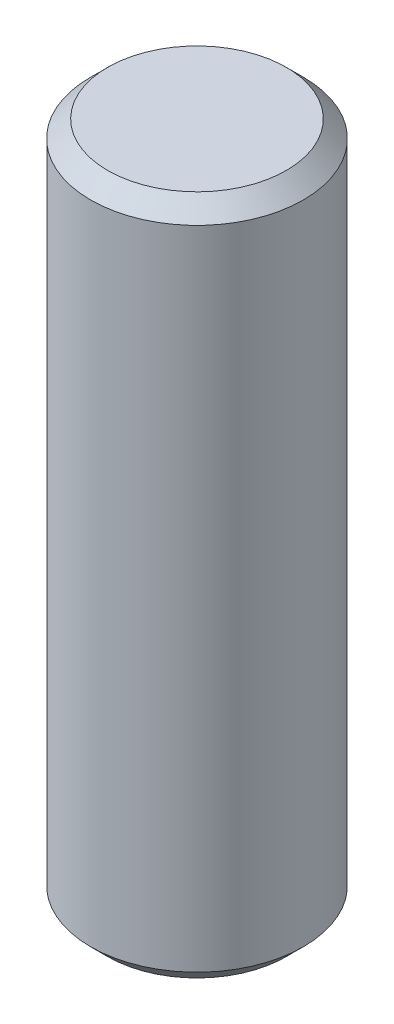
from build123d import *

# Parameters (mm, degrees)
BOSS_EXTRUDE1_DEPTH      = 5.08
BOSS_EXTRUDE1_DEPTH_BACK = 5.08
SKETCH1_R                = 1.5875
CHAMFER1_SIZE            = 0.254


with BuildPart() as part:
    # Sketch1 → Boss-Extrude1 (new, two sides: drawn at the far end of the back side and taken through both)
    with BuildSketch(Plane(origin=(0, 0, 0), x_dir=(1, 0, 0), z_dir=(0, 1, 0)).offset(-BOSS_EXTRUDE1_DEPTH_BACK)):
        Circle(SKETCH1_R)
    extrude(amount=BOSS_EXTRUDE1_DEPTH + BOSS_EXTRUDE1_DEPTH_BACK)

    # Chamfer1
    chamfer1_edges = [part.edges().sort_by_distance(p)[0] for p in [
        (-1.5875, -5.08, 0),
        (-1.5875, 5.08, 0),
    ]]
    chamfer(chamfer1_edges, length=CHAMFER1_SIZE)


solid = part.part
